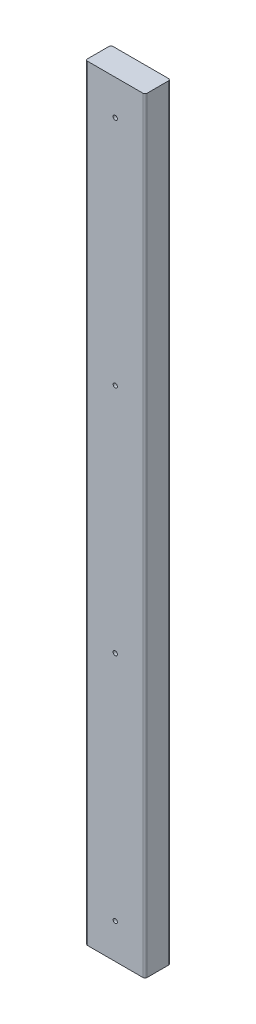
from build123d import *

# Parameters (mm, degrees)
SKETCH1_W                   = 88.9
SKETCH1_H                   = 38.1
BOSS_EXTRUDE1_DEPTH         = 1143
F_1_4_0_25_DIAMETER_HOLE1_D = 6.35
FILLET1_R                   = 3.175


with BuildPart() as part:
    # Sketch1 → Boss-Extrude1 (new body)
    with BuildSketch(Plane(origin=(0, 0, 0), x_dir=(1, 0, 0), z_dir=(0, 1, 0))):
        Rectangle(SKETCH1_W, SKETCH1_H)
    extrude(amount=BOSS_EXTRUDE1_DEPTH)

    # 1/4 (0.25) Diameter Hole1 (through all)
    with Locations(Plane(origin=(0, 0, -19.05), x_dir=(-1, 0, 0), z_dir=(0, 0, -1))):
        with Locations((0, 52.3875), (0, 398.4625), (0, 744.5375), (0, 1090.6125)):
            Hole(F_1_4_0_25_DIAMETER_HOLE1_D / 2)

    # Fillet1
    fillet1_edges = [part.edges().sort_by_distance(p)[0] for p in [
        (-44.45, 571.5, -19.05),
        (44.45, 571.5, -19.05),
        (44.45, 571.5, 19.05),
        (-44.45, 571.5, 19.05),
    ]]
    fillet(fillet1_edges, radius=FILLET1_R)


solid = part.part
